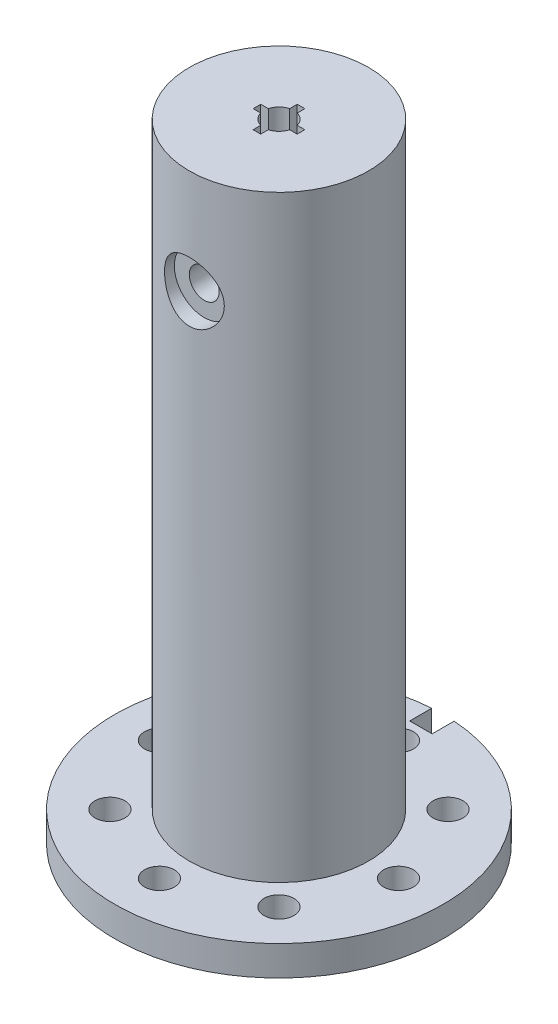
from build123d import *

# Parameters (mm, degrees)
SKETCH1_R               = 11
SKETCH1_R_2             = 1
BOSS_EXTRUDE1_DEPTH     = 2
SKETCH2_R               = 4
CUT_EXTRUDE1_DEPTH      = 16.684387141
SKETCH4_W               = 1.5
SKETCH4_H               = 3
CUT_EXTRUDE3_DEPTH      = 4
BOSS_EXTRUDE2_START     = 20
SKETCH5_R               = 6
SKETCH5_R_2             = 4
BOSS_EXTRUDE2_DEPTH     = 20
BOSS_EXTRUDE3_START     = 20
SKETCH6_R               = 6
BOSS_EXTRUDE3_DEPTH     = 20
CUT_EXTRUDE4_DEPTH      = 5
CUT_EXTRUDE4_DEPTH_BACK = 1
SKETCH7_R               = 1
SKETCH8_R               = 2
CUT_EXTRUDE5_DEPTH      = 1


with BuildPart() as part:
    # Sketch1 → Boss-Extrude1 (new body)
    with BuildSketch(Plane(origin=(0, 0, 0), x_dir=(1, 0, 0), z_dir=(0, 1, 0))):
        with Locations(Location((0, 0, 0), (0, 0, 270))):
            Circle(SKETCH1_R)
        with Locations(Location((0, 8, 0), (0, 0, 270))):
            Circle(SKETCH1_R_2, mode=Mode.SUBTRACT)
        with Locations(Location((5.656854249, 5.656854249, 0), (0, 0, 270))):
            Circle(SKETCH1_R_2, mode=Mode.SUBTRACT)
        with Locations(Location((8, 0, 0), (0, 0, 270))):
            Circle(SKETCH1_R_2, mode=Mode.SUBTRACT)
        with Locations(Location((5.656854249, -5.656854249, 0), (0, 0, 270))):
            Circle(SKETCH1_R_2, mode=Mode.SUBTRACT)
        with Locations(Location((0, -8, 0), (0, 0, 270))):
            Circle(SKETCH1_R_2, mode=Mode.SUBTRACT)
        with Locations(Location((-5.656854249, -5.656854249, 0), (0, 0, 270))):
            Circle(SKETCH1_R_2, mode=Mode.SUBTRACT)
        with Locations(Location((-8, 0, 0), (0, 0, 270))):
            Circle(SKETCH1_R_2, mode=Mode.SUBTRACT)
        with Locations(Location((-5.656854249, 5.656854249, 0), (0, 0, 270))):
            Circle(SKETCH1_R_2, mode=Mode.SUBTRACT)
    extrude(amount=BOSS_EXTRUDE1_DEPTH)

    # Sketch2 → Cut-Extrude1 (cut, through all)
    with BuildSketch(Plane(origin=(0, 2, 0), x_dir=(1, 0, 0), z_dir=(0, 1, 0))):
        with Locations(Location((0, 0, 0), (0, 0, 270))):
            Circle(SKETCH2_R)
    extrude(amount=-CUT_EXTRUDE1_DEPTH, mode=Mode.SUBTRACT)

    # Sketch4 → Cut-Extrude3 (cut)
    with BuildSketch(Plane(origin=(0, 2, 0), x_dir=(1, 0, 0), z_dir=(0, 1, 0))):
        with Locations((0, 11)):
            Rectangle(SKETCH4_W, SKETCH4_H)
    extrude(amount=-CUT_EXTRUDE3_DEPTH, mode=Mode.SUBTRACT)

    # Sketch5 → Boss-Extrude2 (add)
    with BuildSketch(Plane(origin=(0, 2, 0), x_dir=(1, 0, 0), z_dir=(0, 1, 0)).offset(BOSS_EXTRUDE2_START)):
        with Locations(Location((0, 0, 0), (0, 0, 270))):
            Circle(SKETCH5_R)
        with Locations(Location((0, 0, 0), (0, 0, 270))):
            Circle(SKETCH5_R_2, mode=Mode.SUBTRACT)
    extrude(amount=-BOSS_EXTRUDE2_DEPTH)

    # Sketch6 → Boss-Extrude3 (add)
    with BuildSketch(Plane(origin=(0, 22, 0), x_dir=(1, 0, 0), z_dir=(0, 1, 0)).offset(BOSS_EXTRUDE3_START)):
        with Locations(Location((0, 0, 0), (0, 0, 270))):
            Circle(SKETCH6_R)
        with BuildLine():
            ThreePointArc((-0.967204218, 0.254), (-0.707472278, 0.706741095), (-0.255, 0.966941053))
            Line((-0.255, 0.966941053), (-0.255, 1.476941053))
            Line((-0.255, 1.476941053), (0.255, 1.476941053))
            Line((0.255, 1.476941053), (0.255, 0.966941053))
            ThreePointArc((0.255, 0.966941053), (0.707472278, 0.706741095), (0.967204218, 0.254))
            Line((0.967204218, 0.254), (1.475204218, 0.254))
            Line((1.475204218, 0.254), (1.475204218, -0.254))
            Line((1.475204218, -0.254), (0.967204218, -0.254))
            ThreePointArc((0.967204218, -0.254), (0.707106781, -0.707106781), (0.254, -0.967204218))
            Line((0.254, -0.967204218), (0.254, -1.475204218))
            Line((0.254, -1.475204218), (-0.254, -1.475204218))
            Line((-0.254, -1.475204218), (-0.254, -0.967204218))
            ThreePointArc((-0.254, -0.967204218), (-0.707106781, -0.707106781), (-0.967204218, -0.254))
            Line((-0.967204218, -0.254), (-1.475204218, -0.254))
            Line((-1.475204218, -0.254), (-1.475204218, 0.254))
            Line((-1.475204218, 0.254), (-0.967204218, 0.254))
        make_face(mode=Mode.SUBTRACT)
    extrude(amount=-BOSS_EXTRUDE3_DEPTH)

    # Sketch7 → Cut-Extrude4 (cut, two sides: drawn at the far end of the back side and taken through both)
    with BuildSketch(Plane.XY.offset(-CUT_EXTRUDE4_DEPTH_BACK)):
        with Locations(Location((0, 35, 0), (0, 0, 165.285661458))):
            Circle(SKETCH7_R)
    extrude(amount=CUT_EXTRUDE4_DEPTH + CUT_EXTRUDE4_DEPTH_BACK, mode=Mode.SUBTRACT)

    # Sketch8 → Cut-Extrude5 (cut)
    with BuildSketch(Plane.XY.offset(6)):
        with Locations((0, 35)):
            Circle(SKETCH8_R)
    extrude(amount=-CUT_EXTRUDE5_DEPTH, mode=Mode.SUBTRACT)


solid = part.part
